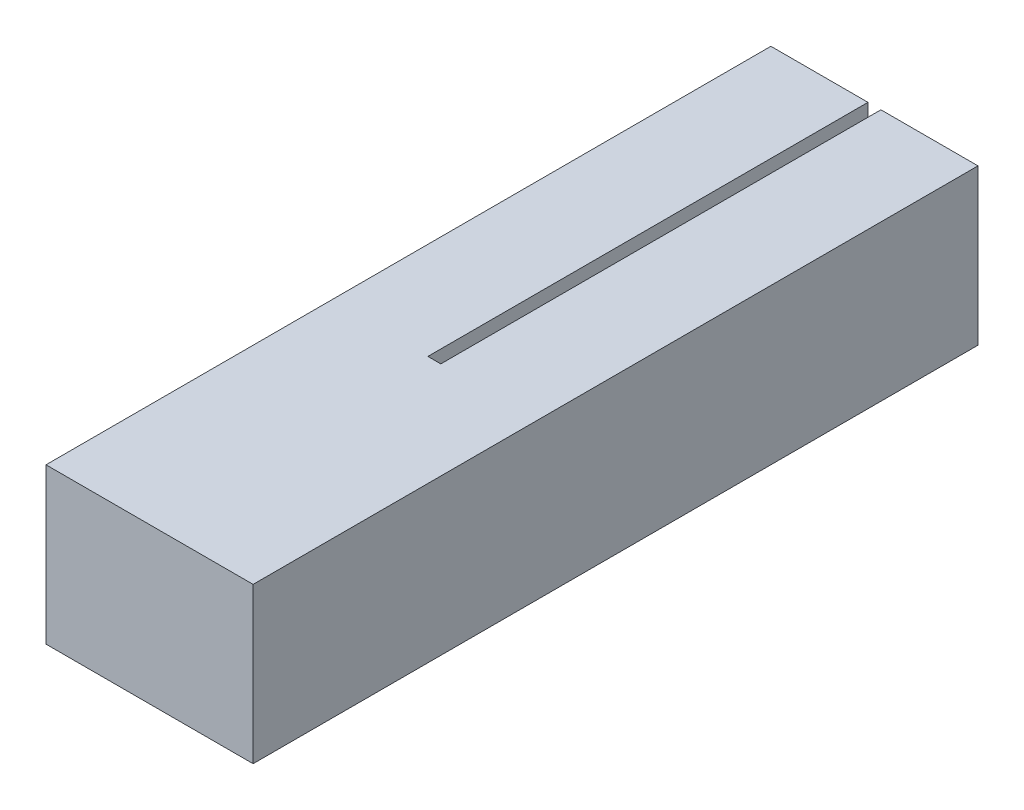
from build123d import *

# Parameters (mm, degrees)
SKETCH1_W           = 25.4
SKETCH1_H           = 88.9
BOSS_EXTRUDE1_DEPTH = 19.05
SKETCH2_W           = 1.5875
SKETCH2_H           = 53.975
CUT_EXTRUDE1_DEPTH  = 95.399536545


with BuildPart() as part:
    # Sketch1 → Boss-Extrude1 (new body)
    with BuildSketch(Plane(origin=(0, 0, 0), x_dir=(1, 0, 0), z_dir=(0, 1, 0))):
        with Locations((12.7, 44.45)):
            Rectangle(SKETCH1_W, SKETCH1_H)
    extrude(amount=BOSS_EXTRUDE1_DEPTH)

    # Sketch2 → Cut-Extrude1 (cut, through all)
    with BuildSketch(Plane(origin=(0, 19.05, 0), x_dir=(1, 0, 0), z_dir=(0, 1, 0))):
        with Locations((12.7, 61.9125)):
            Rectangle(SKETCH2_W, SKETCH2_H)
    extrude(amount=-CUT_EXTRUDE1_DEPTH, mode=Mode.SUBTRACT)


solid = part.part
